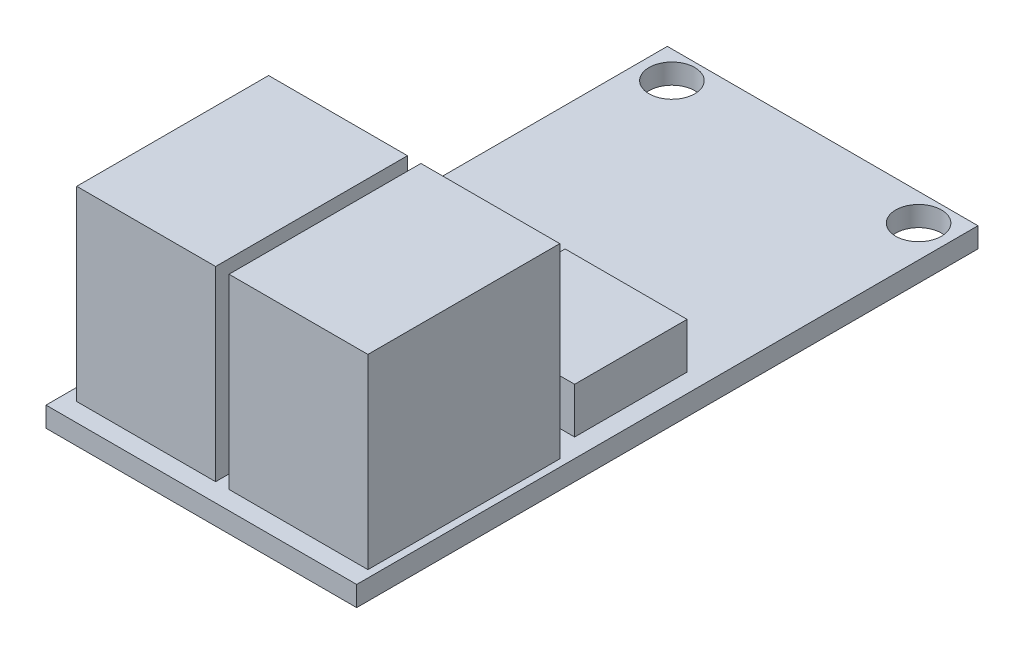
from build123d import *

# Parameters (mm, degrees)
SKETCH1_W             = 17
SKETCH1_H             = 34
SKETCH1_R             = 1.25
BOSS_EXTRUDE1_DEPTH   = 1.1
SKETCH2_W             = 7.6
SKETCH2_H             = 10.5
BOSS_EXTRUDE2_DEPTH   = 10.2
BOSS_EXTRUDE2_2_DEPTH = 10.2
SKETCH3_W             = 6.386882644
SKETCH3_H             = 6.153216206
BOSS_EXTRUDE3_DEPTH   = 2.5
SKETCH3_W_2           = 6.673523979
BOSS_EXTRUDE3_2_DEPTH = 2.5


with BuildPart() as part:
    # Sketch1 → Boss-Extrude1 (new body)
    with BuildSketch(Plane(origin=(0, 0, 0), x_dir=(1, 0, 0), z_dir=(0, 1, 0))):
        with Locations((8.5, 17)):
            Rectangle(SKETCH1_W, SKETCH1_H)
        with Locations(Location((1.75, 32.5, 0), (0, 0, 270))):
            Circle(SKETCH1_R, mode=Mode.SUBTRACT)
        with Locations(Location((15.25, 32.5, 0), (0, 0, 270))):
            Circle(SKETCH1_R, mode=Mode.SUBTRACT)
    extrude(amount=BOSS_EXTRUDE1_DEPTH)


with BuildPart() as body_2:
    # Sketch2 → Boss-Extrude2 (new body)
    with BuildSketch(Plane(origin=(0, 1.1, 0), x_dir=(1, 0, 0), z_dir=(0, 1, 0))):
        with Locations((4.472174321, 6.258838703)):
            Rectangle(SKETCH2_W, SKETCH2_H)
    extrude(amount=BOSS_EXTRUDE2_DEPTH)


with BuildPart() as body_3:
    # Sketch2 → Boss-Extrude2 2 (new body)
    with BuildSketch(Plane(origin=(0, 1.1, 0), x_dir=(1, 0, 0), z_dir=(0, 1, 0))):
        with Locations((12.806277283, 6.258838703)):
            Rectangle(SKETCH2_W, SKETCH2_H)
    extrude(amount=BOSS_EXTRUDE2_2_DEPTH)


with BuildPart() as body_4:
    # Sketch3 → Boss-Extrude3 (new body)
    with BuildSketch(Plane(origin=(0, 1.1, 0), x_dir=(1, 0, 0), z_dir=(0, 1, 0))):
        with Locations((4.527670551, 16.026389841)):
            Rectangle(SKETCH3_W, SKETCH3_H)
    extrude(amount=BOSS_EXTRUDE3_DEPTH)


with BuildPart() as body_5:
    # Sketch3 → Boss-Extrude3 2 (new body)
    with BuildSketch(Plane(origin=(0, 1.1, 0), x_dir=(1, 0, 0), z_dir=(0, 1, 0))):
        with Locations((12.640564033, 16.026389841)):
            Rectangle(SKETCH3_W_2, SKETCH3_H)
    extrude(amount=BOSS_EXTRUDE3_2_DEPTH)


solid = Compound([part.part, body_2.part, body_3.part, body_4.part, body_5.part])
